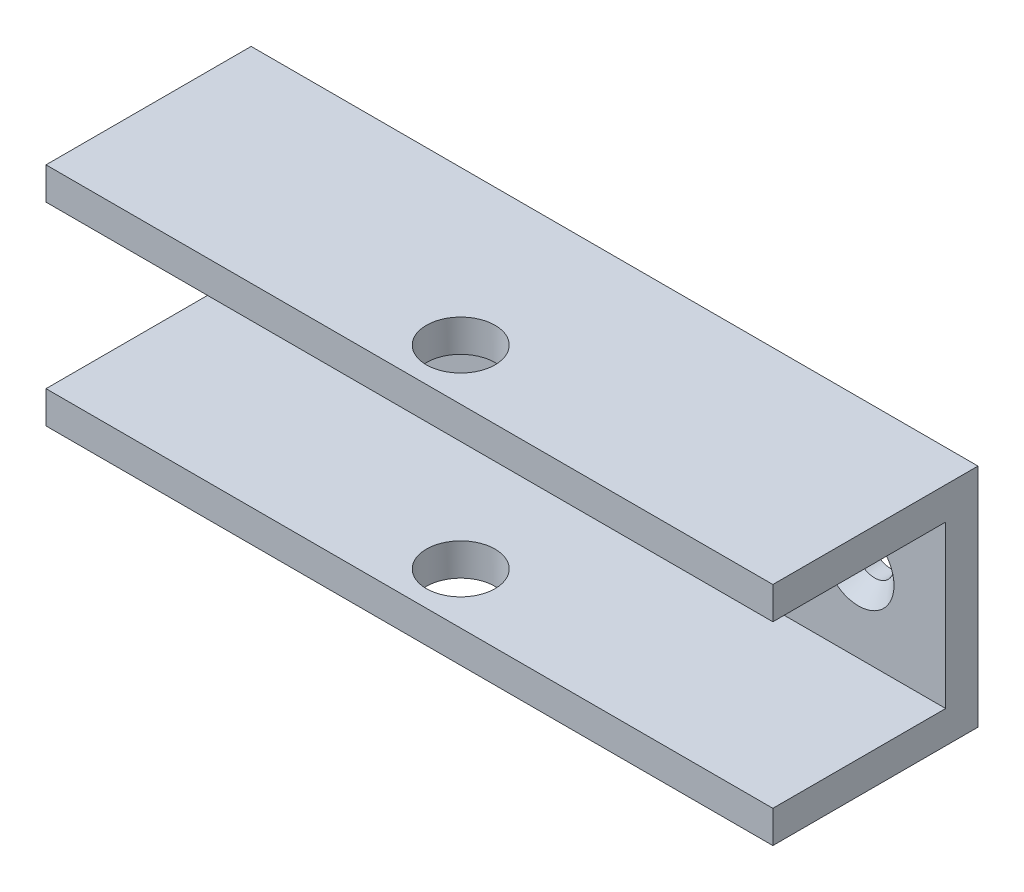
from build123d import *

# Parameters (mm, degrees)
SKETCH1_W                                      = 45
SKETCH1_H                                      = 14
BOSS_EXTRUDE1_DEPTH                            = 12.7
SKETCH2_W                                      = 45
SKETCH2_H                                      = 10
CUT_EXTRUDE1_DEPTH                             = 10.7
CSK_FOR_M2_FLAT_HEAD_MACHINE_SCREW1_AT_2_COUNT = 2
CSK_FOR_M2_FLAT_HEAD_MACHINE_SCREW1_AT_2_PITCH = 34.2
CUT_EXTRUDE2_DEPTH                             = 30.386051113
CUT_EXTRUDE2_DEPTH_BACK                        = 30.386051113
SKETCH5_R                                      = 2.125


with BuildPart() as part:
    # Sketch1 → Boss-Extrude1 (new body)
    with BuildSketch(Plane.XY):
        Rectangle(SKETCH1_W, SKETCH1_H)
    extrude(amount=BOSS_EXTRUDE1_DEPTH)

    # Sketch2 → Cut-Extrude1 (cut)
    with BuildSketch(Plane.XY.offset(12.7)):
        Rectangle(SKETCH2_W, SKETCH2_H)
    extrude(amount=-CUT_EXTRUDE1_DEPTH, mode=Mode.SUBTRACT)

    # Sketch3 → CSK for M2 Flat Head Machine Screw1 (revolve, cut)
    with BuildSketch(Plane(origin=(-17.1, 0, 2), x_dir=(0, -1, 0), z_dir=(1, 0, 0))):
        Polygon((0, 0), (0, 2), (1.2, 2), (1.2, 1), (2.2, 0), align=None)
    csk_for_m2_flat_head_machine_screw1 = revolve(axis=Axis((-17.1, 0, 8.35), (0, 0, -1)), mode=Mode.SUBTRACT)

    # CSK for M2 Flat Head Machine Screw1 at 2: CSK for M2 Flat Head Machine Screw1 ×2
    with Locations(*[(i * CSK_FOR_M2_FLAT_HEAD_MACHINE_SCREW1_AT_2_PITCH, 0, 0) for i in range(1, CSK_FOR_M2_FLAT_HEAD_MACHINE_SCREW1_AT_2_COUNT)]):
        add(csk_for_m2_flat_head_machine_screw1, mode=Mode.SUBTRACT)

    # Sketch5 → Cut-Extrude2 (cut, two sides: drawn at the far end of the back side and taken through both)
    with BuildSketch(Plane(origin=(0, 7, 0), x_dir=(1, 0, 0), z_dir=(0, 1, 0)).offset(-CUT_EXTRUDE2_DEPTH_BACK)):
        with Locations((0, -9.525)):
            Circle(SKETCH5_R)
    extrude(amount=CUT_EXTRUDE2_DEPTH + CUT_EXTRUDE2_DEPTH_BACK, mode=Mode.SUBTRACT)


solid = part.part
